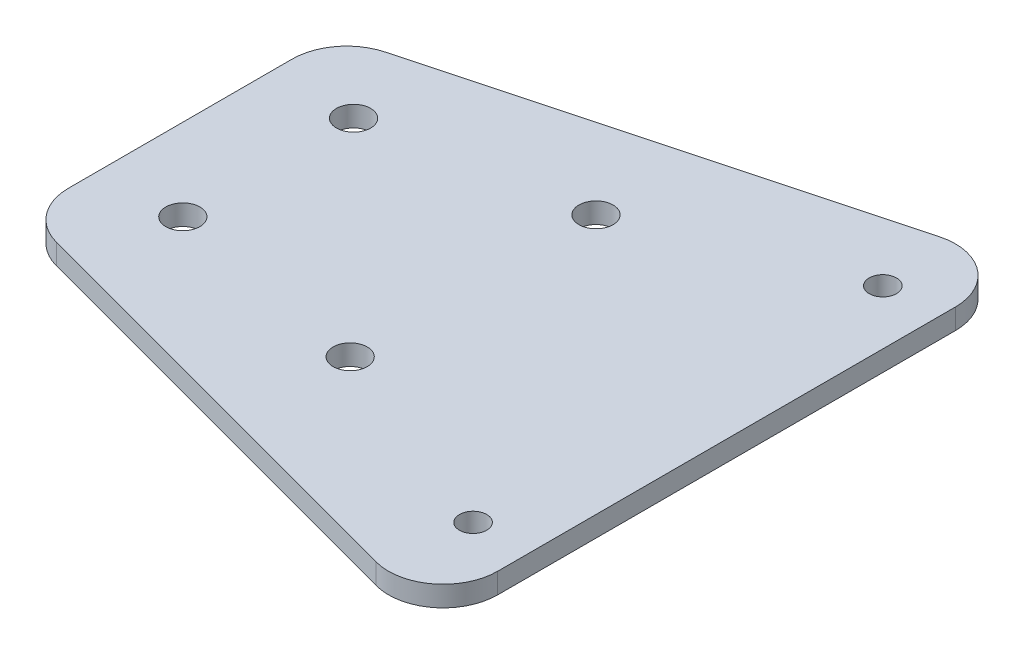
from build123d import *

# Parameters (mm, degrees)
BOSS_EXTRUDE1_DEPTH = 1.5
SKETCH3_R           = 2
SKETCH3_R_2         = 2.5
CUT_EXTRUDE1_DEPTH  = 3


with BuildPart() as part:
    # Sketch2 → Boss-Extrude1 (new, symmetric)
    with BuildSketch(Plane(origin=(0, 0, 0), x_dir=(1, 0, 0), z_dir=(0, 1, 0))):
        with BuildLine():
            Line((-41.420454545, -12.342725783), (-41.420454545, 20.380644913))
            ThreePointArc((-41.420454545, 20.380644913), (-39.767396696, 25.250585912), (-35.49137321, 28.107953363))
            Line((-35.49137321, 28.107953363), (28.50862679, 45.259953363))
            ThreePointArc((28.50862679, 45.259953363), (35.449486454, 43.879587063), (38.579545455, 37.532644913))
            Line((38.579545455, 37.532644913), (38.579545455, -29.494725783))
            ThreePointArc((38.579545455, -29.494725783), (35.449486454, -35.841667933), (28.50862679, -37.222034233))
            Line((28.50862679, -37.222034233), (-35.49137321, -20.070034233))
            ThreePointArc((-35.49137321, -20.070034233), (-39.767396696, -17.212666783), (-41.420454545, -12.342725783))
        make_face()
    extrude(amount=BOSS_EXTRUDE1_DEPTH, both=True)

    # Sketch3 → Cut-Extrude1 (cut)
    with BuildSketch(Plane(origin=(0, 1.5, 0), x_dir=(1, 0, 0), z_dir=(0, 1, 0))):
        with Locations(Location((30.579545455, 34.894152552, 0), (0, 0, 270))):
            Circle(SKETCH3_R)
        with Locations(Location((0.579545455, 22.894152552, 0), (0, 0, 270))):
            Circle(SKETCH3_R_2)
        with Locations(Location((-29.420454545, 17.394152552, 0), (0, 0, 270))):
            Circle(SKETCH3_R_2)
        with Locations(Location((30.579545455, -25.105847448, 0), (0, 0, 90))):
            Circle(SKETCH3_R)
        with Locations(Location((0.579545455, -13.105847448, 0), (0, 0, 90))):
            Circle(SKETCH3_R_2)
        with Locations(Location((-29.420454545, -7.605847448, 0), (0, 0, 90))):
            Circle(SKETCH3_R_2)
    extrude(amount=-CUT_EXTRUDE1_DEPTH, mode=Mode.SUBTRACT)


solid = part.part
